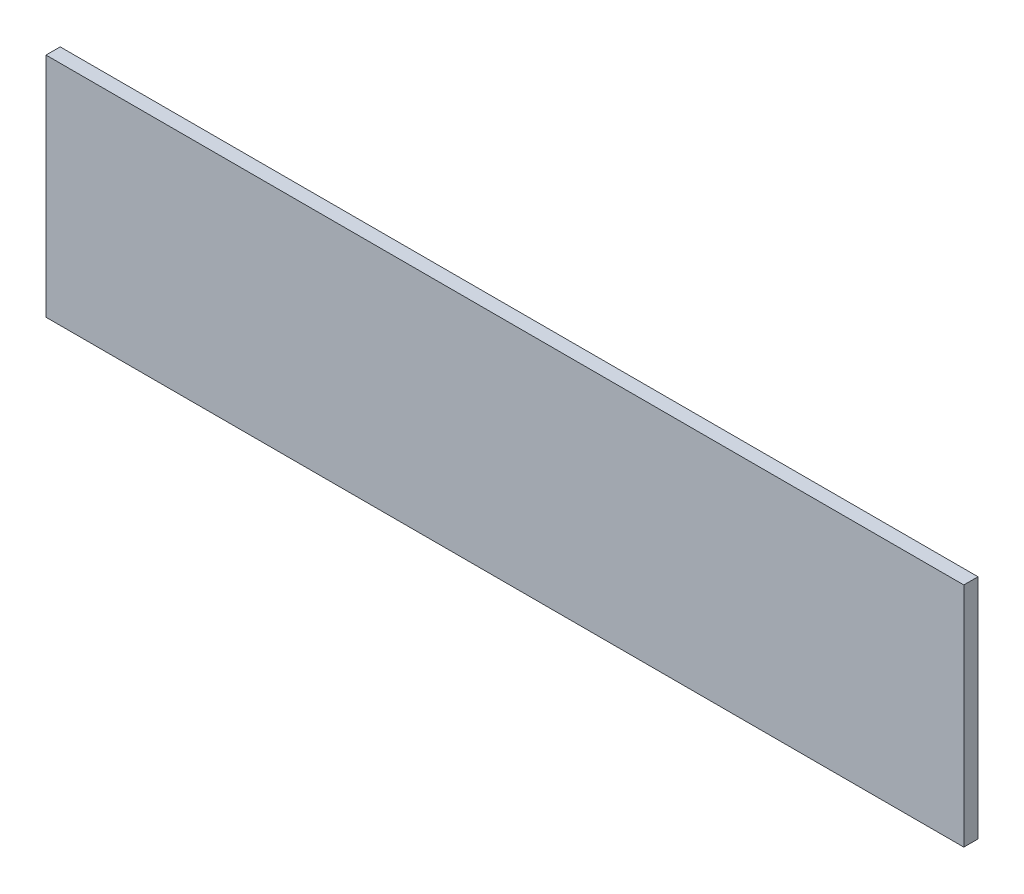
from build123d import *

# Parameters (mm, degrees)
SKETCH1_W           = 97
SKETCH1_H           = 24
BOSS_EXTRUDE1_DEPTH = 1.5


with BuildPart() as part:
    # Sketch1 → Boss-Extrude1 (new body)
    with BuildSketch(Plane.XY):
        Rectangle(SKETCH1_W, SKETCH1_H)
    extrude(amount=BOSS_EXTRUDE1_DEPTH)


solid = part.part
